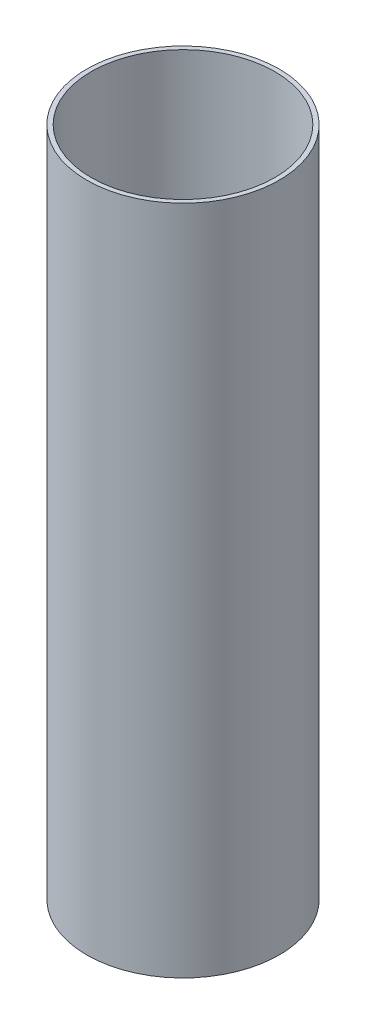
from build123d import *

# Parameters (mm, degrees)
SZKIC1_W = 3
SZKIC1_H = 453


with BuildPart() as part:
    # Szkic1 → Obrót1 (revolve)
    with BuildSketch(Plane.XY, mode=Mode.PRIVATE) as obr_t1_sk:
        with Locations((63.5, 0)):
            Rectangle(SZKIC1_W, SZKIC1_H)
    revolve(obr_t1_sk.sketch.rotate(Axis((0, 150, 0), (0, -1, 0)), 90), axis=Axis((0, 150, 0), (0, -1, 0)))


solid = part.part
